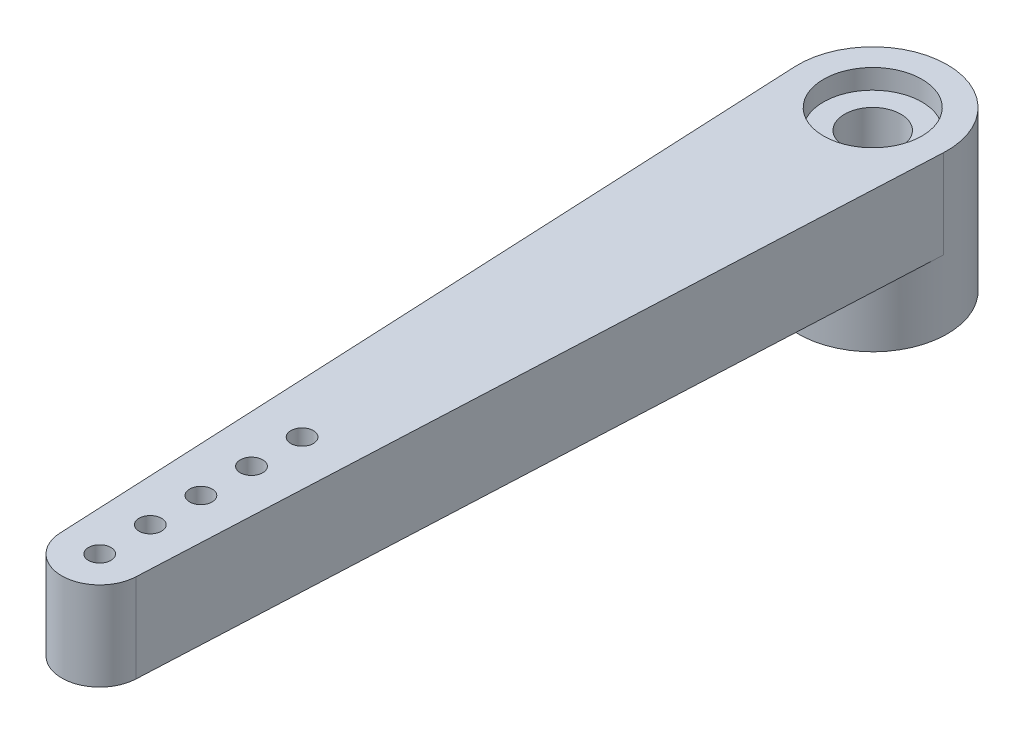
from build123d import *

# Parameters (mm, degrees)
BOSS_EXTRUDE1_DEPTH = 4
BOSS_EXTRUDE2_START = 3.175
SKETCH2_R           = 3.3655
BOSS_EXTRUDE2_DEPTH = 3.175
CUT_EXTRUDE1_DEPTH  = 2.286
CUT_EXTRUDE2_START  = -0.889
SKETCH4_R           = 2.2225
CUT_EXTRUDE2_DEPTH  = 0.889
CUT_EXTRUDE3_REACH  = 39.322
SKETCH5_R           = 1.27
CUT_EXTRUDE4_REACH  = 39.482
SKETCH6_R           = 0.508


with BuildPart() as part:
    # Sketch1 → Boss-Extrude1 (new body)
    with BuildSketch(Plane(origin=(0, 0, 0), x_dir=(1, 0, 0), z_dir=(0, 1, 0))):
        with BuildLine():
            Line((-1.712582674, -35.001060696), (-3.361736359, -0.159119144))
            ThreePointArc((-3.361736359, -0.159119144), (0, 3.3655), (3.361736359, -0.159119144))
            Line((3.361736359, -0.159119144), (1.712582674, -35.001060696))
            ThreePointArc((1.712582674, -35.001060696), (0, -36.6345), (-1.712582674, -35.001060696))
        make_face()
    extrude(amount=BOSS_EXTRUDE1_DEPTH)

    # Sketch2 → Boss-Extrude2 (add)
    with BuildSketch(Plane.XZ.offset(BOSS_EXTRUDE2_START)):
        with Locations(Location((0, 0, 0), (0, 0, 270))):
            Circle(SKETCH2_R)
    extrude(amount=-BOSS_EXTRUDE2_DEPTH)

    # Sketch3 → Cut-Extrude1 (cut)
    with BuildSketch(Plane(origin=(0, -3.175, 0), x_dir=(-1, 0, 0), z_dir=(0, -1, 0))):
        with BuildLine():
            Line((0.344662185, 2.452398872), (0.160511142, 2.216696286))
            ThreePointArc((0.160511142, 2.216696286), (0.155033763, 2.217086102), (0.149555438, 2.217462383))
            Line((0.149555438, 2.217462383), (0, 2.4765))
            Line((0, 2.4765), (-0.149555438, 2.217462383))
            ThreePointArc((-0.149555438, 2.217462383), (-0.155033763, 2.217086102), (-0.160511142, 2.216696286))
            Line((-0.160511142, 2.216696286), (-0.344662185, 2.452398872))
            Line((-0.344662185, 2.452398872), (-0.456711091, 2.175068098))
            ThreePointArc((-0.456711091, 2.175068098), (-0.462083733, 2.173933043), (-0.467453554, 2.172784717))
            Line((-0.467453554, 2.172784717), (-0.682615912, 2.38056459))
            Line((-0.682615912, 2.38056459), (-0.754977382, 2.090338586))
            ThreePointArc((-0.754977382, 2.090338586), (-0.760139769, 2.08846685), (-0.765297515, 2.086582364))
            Line((-0.765297515, 2.086582364), (-1.007283297, 2.262395326))
            Line((-1.007283297, 2.262395326), (-1.038548897, 1.964923011))
            ThreePointArc((-1.038548897, 1.964923011), (-1.043400548, 1.962351025), (-1.04824583, 1.95976706))
            Line((-1.04824583, 1.95976706), (-1.312345058, 2.10019111))
            Line((-1.312345058, 2.10019111), (-1.301906239, 1.801262445))
            ThreePointArc((-1.301906239, 1.801262445), (-1.306352723, 1.79804027), (-1.310791233, 1.794807119))
            Line((-1.310791233, 1.794807119), (-1.591863515, 1.897109063))
            Line((-1.591863515, 1.897109063), (-1.539923457, 1.602542354))
            ThreePointArc((-1.539923457, 1.602542354), (-1.543878228, 1.598732706), (-1.547823575, 1.594913299))
            Line((-1.547823575, 1.594913299), (-1.84039816, 1.657101947))
            Line((-1.84039816, 1.657101947), (-1.747967817, 1.372630599))
            ThreePointArc((-1.747967817, 1.372630599), (-1.7513539, 1.368307629), (-1.754729292, 1.363976306))
            Line((-1.754729292, 1.363976306), (-2.053111548, 1.384841225))
            Line((-2.053111548, 1.384841225), (-1.921989971, 1.116002151))
            ThreePointArc((-1.921989971, 1.116002151), (-1.92474146, 1.11125), (-1.927481199, 1.106491065))
            Line((-1.927481199, 1.106491065), (-2.225863456, 1.085626145))
            Line((-2.225863456, 1.085626145), (-2.058602777, 0.837651991))
            ThreePointArc((-2.058602777, 0.837651991), (-2.060666117, 0.832563154), (-2.062716877, 0.827469234))
            Line((-2.062716877, 0.827469234), (-2.355291463, 0.765280587))
            Line((-2.355291463, 0.765280587), (-2.155147221, 0.542997887))
            ThreePointArc((-2.155147221, 0.542997887), (-2.156482252, 0.537671413), (-2.157804118, 0.532341657))
            Line((-2.157804118, 0.532341657), (-2.4388764, 0.430039712))
            Line((-2.4388764, 0.430039712), (-2.209744176, 0.237774947))
            ThreePointArc((-2.209744176, 0.237774947), (-2.210324912, 0.23231451), (-2.210892156, 0.226852654))
            Line((-2.210892156, 0.226852654), (-2.474991383, 0.086428604))
            Line((-2.474991383, 0.086428604), (-2.221330975, -0.072076012))
            ThreePointArc((-2.221330975, -0.072076012), (-2.221146113, -0.077564131), (-2.220947692, -0.083051778))
            Line((-2.220947692, -0.083051778), (-2.462933474, -0.258864739))
            Line((-2.462933474, -0.258864739), (-2.189682092, -0.380524093))
            ThreePointArc((-2.189682092, -0.380524093), (-2.188735231, -0.385933075), (-2.187775009, -0.391339701))
            Line((-2.187775009, -0.391339701), (-2.402937366, -0.599119574))
            Line((-2.402937366, -0.599119574), (-2.115413539, -0.681565705))
            ThreePointArc((-2.115413539, -0.681565705), (-2.113723107, -0.68679027), (-2.112019773, -0.692010642))
            Line((-2.112019773, -0.692010642), (-2.296170816, -0.927713229))
            Line((-2.296170816, -0.927713229), (-1.999970867, -0.969341417))
            ThreePointArc((-1.999970867, -0.969341417), (-1.997569768, -0.974279874), (-1.995156475, -0.979212383))
            Line((-1.995156475, -0.979212383), (-2.144711912, -1.23825))
            Line((-2.144711912, -1.23825), (-1.845601037, -1.23825))
            ThreePointArc((-1.845601037, -1.23825), (-1.842536005, -1.242806228), (-1.839459725, -1.247354869))
            Line((-1.839459725, -1.247354869), (-1.951508631, -1.524685644))
            Line((-1.951508631, -1.524685644), (-1.655308682, -1.483057456))
            ThreePointArc((-1.655308682, -1.483057456), (-1.651639375, -1.487142773), (-1.647959984, -1.491219011))
            Line((-1.647959984, -1.491219011), (-1.720321454, -1.781445016))
            Line((-1.720321454, -1.781445016), (-1.432797627, -1.698998885))
            ThreePointArc((-1.432797627, -1.698998885), (-1.428595463, -1.702533775), (-1.424384577, -1.706058272))
            Line((-1.424384577, -1.706058272), (-1.455650177, -2.003530587))
            Line((-1.455650177, -2.003530587), (-1.182398796, -1.881871233))
            ThreePointArc((-1.182398796, -1.881871233), (-1.177745565, -1.884786894), (-1.173085144, -1.887691048))
            Line((-1.173085144, -1.887691048), (-1.162646325, -2.186619714))
            Line((-1.162646325, -2.186619714), (-0.908985917, -2.028115099))
            ThreePointArc((-0.908985917, -2.028115099), (-0.903972189, -2.03035478), (-0.898952943, -2.032582066))
            Line((-0.898952943, -2.032582066), (-0.847012885, -2.327148775))
            Line((-0.847012885, -2.327148775), (-0.617880661, -2.134884011))
            ThreePointArc((-0.617880661, -2.134884011), (-0.612604023, -2.136404119), (-0.607323646, -2.137911186))
            Line((-0.607323646, -2.137911186), (-0.514893302, -2.422382533))
            Line((-0.514893302, -2.422382533), (-0.314749061, -2.200099834))
            ThreePointArc((-0.314749061, -2.200099834), (-0.309312217, -2.200870783), (-0.303873485, -2.201628296))
            Line((-0.303873485, -2.201628296), (-0.172751907, -2.47046737))
            Line((-0.172751907, -2.47046737), (-0.005491228, -2.222493216))
            ThreePointArc((-0.005491228, -2.222493216), (0, -2.2225), (0.005491228, -2.222493216))
            Line((0.005491228, -2.222493216), (0.172751907, -2.47046737))
            Line((0.172751907, -2.47046737), (0.303873485, -2.201628296))
            ThreePointArc((0.303873485, -2.201628296), (0.309312217, -2.200870783), (0.314749061, -2.200099834))
            Line((0.314749061, -2.200099834), (0.514893302, -2.422382533))
            Line((0.514893302, -2.422382533), (0.607323646, -2.137911186))
            ThreePointArc((0.607323646, -2.137911186), (0.612604023, -2.136404119), (0.617880661, -2.134884011))
            Line((0.617880661, -2.134884011), (0.847012885, -2.327148775))
            Line((0.847012885, -2.327148775), (0.898952943, -2.032582066))
            ThreePointArc((0.898952943, -2.032582066), (0.903972189, -2.03035478), (0.908985917, -2.028115099))
            Line((0.908985917, -2.028115099), (1.162646325, -2.186619714))
            Line((1.162646325, -2.186619714), (1.173085144, -1.887691048))
            ThreePointArc((1.173085144, -1.887691048), (1.177745565, -1.884786894), (1.182398796, -1.881871233))
            Line((1.182398796, -1.881871233), (1.455650177, -2.003530587))
            Line((1.455650177, -2.003530587), (1.424384577, -1.706058272))
            ThreePointArc((1.424384577, -1.706058272), (1.428595463, -1.702533775), (1.432797627, -1.698998885))
            Line((1.432797627, -1.698998885), (1.720321454, -1.781445016))
            Line((1.720321454, -1.781445016), (1.647959984, -1.491219011))
            ThreePointArc((1.647959984, -1.491219011), (1.651639375, -1.487142773), (1.655308682, -1.483057456))
            Line((1.655308682, -1.483057456), (1.951508631, -1.524685644))
            Line((1.951508631, -1.524685644), (1.839459725, -1.247354869))
            ThreePointArc((1.839459725, -1.247354869), (1.842536005, -1.242806228), (1.845601037, -1.23825))
            Line((1.845601037, -1.23825), (2.144711912, -1.23825))
            Line((2.144711912, -1.23825), (1.995156475, -0.979212383))
            ThreePointArc((1.995156475, -0.979212383), (1.997569768, -0.974279874), (1.999970867, -0.969341417))
            Line((1.999970867, -0.969341417), (2.296170816, -0.927713229))
            Line((2.296170816, -0.927713229), (2.112019773, -0.692010642))
            ThreePointArc((2.112019773, -0.692010642), (2.113723107, -0.68679027), (2.115413539, -0.681565705))
            Line((2.115413539, -0.681565705), (2.402937366, -0.599119574))
            Line((2.402937366, -0.599119574), (2.187775009, -0.391339701))
            ThreePointArc((2.187775009, -0.391339701), (2.188735231, -0.385933075), (2.189682092, -0.380524093))
            Line((2.189682092, -0.380524093), (2.462933474, -0.258864739))
            Line((2.462933474, -0.258864739), (2.220947692, -0.083051778))
            ThreePointArc((2.220947692, -0.083051778), (2.221146113, -0.077564131), (2.221330975, -0.072076012))
            Line((2.221330975, -0.072076012), (2.474991383, 0.086428604))
            Line((2.474991383, 0.086428604), (2.210892156, 0.226852654))
            ThreePointArc((2.210892156, 0.226852654), (2.210324912, 0.23231451), (2.209744176, 0.237774947))
            Line((2.209744176, 0.237774947), (2.4388764, 0.430039712))
            Line((2.4388764, 0.430039712), (2.157804118, 0.532341657))
            ThreePointArc((2.157804118, 0.532341657), (2.156482252, 0.537671413), (2.155147221, 0.542997887))
            Line((2.155147221, 0.542997887), (2.355291463, 0.765280587))
            Line((2.355291463, 0.765280587), (2.062716877, 0.827469234))
            ThreePointArc((2.062716877, 0.827469234), (2.060666117, 0.832563154), (2.058602777, 0.837651991))
            Line((2.058602777, 0.837651991), (2.225863456, 1.085626145))
            Line((2.225863456, 1.085626145), (1.927481199, 1.106491065))
            ThreePointArc((1.927481199, 1.106491065), (1.92474146, 1.11125), (1.921989971, 1.116002151))
            Line((1.921989971, 1.116002151), (2.053111548, 1.384841225))
            Line((2.053111548, 1.384841225), (1.754729292, 1.363976306))
            ThreePointArc((1.754729292, 1.363976306), (1.7513539, 1.368307629), (1.747967817, 1.372630599))
            Line((1.747967817, 1.372630599), (1.84039816, 1.657101947))
            Line((1.84039816, 1.657101947), (1.547823575, 1.594913299))
            ThreePointArc((1.547823575, 1.594913299), (1.543878228, 1.598732706), (1.539923457, 1.602542354))
            Line((1.539923457, 1.602542354), (1.591863515, 1.897109063))
            Line((1.591863515, 1.897109063), (1.310791233, 1.794807119))
            ThreePointArc((1.310791233, 1.794807119), (1.306352723, 1.79804027), (1.301906239, 1.801262445))
            Line((1.301906239, 1.801262445), (1.312345058, 2.10019111))
            Line((1.312345058, 2.10019111), (1.04824583, 1.95976706))
            ThreePointArc((1.04824583, 1.95976706), (1.043400548, 1.962351025), (1.038548897, 1.964923011))
            Line((1.038548897, 1.964923011), (1.007283297, 2.262395326))
            Line((1.007283297, 2.262395326), (0.765297515, 2.086582364))
            ThreePointArc((0.765297515, 2.086582364), (0.760139769, 2.08846685), (0.754977382, 2.090338586))
            Line((0.754977382, 2.090338586), (0.682615912, 2.38056459))
            Line((0.682615912, 2.38056459), (0.467453554, 2.172784717))
            ThreePointArc((0.467453554, 2.172784717), (0.462083733, 2.173933043), (0.456711091, 2.175068098))
            Line((0.456711091, 2.175068098), (0.344662185, 2.452398872))
        make_face()
    extrude(amount=-CUT_EXTRUDE1_DEPTH, mode=Mode.SUBTRACT)

    # Sketch4 → Cut-Extrude2 (cut)
    with BuildSketch(Plane(origin=(0, 4, 0), x_dir=(1, 0, 0), z_dir=(0, 1, 0)).offset(CUT_EXTRUDE2_START)):
        with Locations(Location((0, 0, 0), (0, 0, 270))):
            Circle(SKETCH4_R)
    extrude(amount=CUT_EXTRUDE2_DEPTH, mode=Mode.SUBTRACT)

    # Sketch5 → Cut-Extrude3 (cut, up to next)
    with BuildSketch(Plane(origin=(0, 3.111, 0), x_dir=(1, 0, 0), z_dir=(0, 1, 0)), mode=Mode.PRIVATE) as cut_extrude3_sk1:
        with Locations(Location((0, 0, 0), (0, 0, 270))):
            Circle(SKETCH5_R)
    cut_extrude3_tool1 = extrude(cut_extrude3_sk1.sketch, amount=-CUT_EXTRUDE3_REACH, mode=Mode.PRIVATE) & part.part
    add(cut_extrude3_tool1.solids().sort_by_distance((0, 3.111, 0))[0], mode=Mode.SUBTRACT)

    # Sketch6 → Cut-Extrude4 (cut, up to next)
    with BuildSketch(Plane(origin=(0, 4, 0), x_dir=(1, 0, 0), z_dir=(0, 1, 0)), mode=Mode.PRIVATE) as cut_extrude4_sk1:
        with Locations(Location((0, -34.92, 0), (0, 0, 270))):
            Circle(SKETCH6_R)
    cut_extrude4_tool1 = extrude(cut_extrude4_sk1.sketch, amount=-CUT_EXTRUDE4_REACH, mode=Mode.PRIVATE) & part.part
    # Sketch6 → Cut-Extrude4 (cut, up to next)
    with BuildSketch(Plane(origin=(0, 4, 0), x_dir=(1, 0, 0), z_dir=(0, 1, 0)), mode=Mode.PRIVATE) as cut_extrude4_sk2:
        with Locations(Location((0, -32.634, 0), (0, 0, 270))):
            Circle(SKETCH6_R)
    cut_extrude4_tool2 = extrude(cut_extrude4_sk2.sketch, amount=-CUT_EXTRUDE4_REACH, mode=Mode.PRIVATE) & part.part
    # Sketch6 → Cut-Extrude4 (cut, up to next)
    with BuildSketch(Plane(origin=(0, 4, 0), x_dir=(1, 0, 0), z_dir=(0, 1, 0)), mode=Mode.PRIVATE) as cut_extrude4_sk3:
        with Locations(Location((0, -30.348, 0), (0, 0, 270))):
            Circle(SKETCH6_R)
    cut_extrude4_tool3 = extrude(cut_extrude4_sk3.sketch, amount=-CUT_EXTRUDE4_REACH, mode=Mode.PRIVATE) & part.part
    # Sketch6 → Cut-Extrude4 (cut, up to next)
    with BuildSketch(Plane(origin=(0, 4, 0), x_dir=(1, 0, 0), z_dir=(0, 1, 0)), mode=Mode.PRIVATE) as cut_extrude4_sk4:
        with Locations(Location((0, -28.062, 0), (0, 0, 270))):
            Circle(SKETCH6_R)
    cut_extrude4_tool4 = extrude(cut_extrude4_sk4.sketch, amount=-CUT_EXTRUDE4_REACH, mode=Mode.PRIVATE) & part.part
    # Sketch6 → Cut-Extrude4 (cut, up to next)
    with BuildSketch(Plane(origin=(0, 4, 0), x_dir=(1, 0, 0), z_dir=(0, 1, 0)), mode=Mode.PRIVATE) as cut_extrude4_sk5:
        with Locations(Location((0, -25.776, 0), (0, 0, 270))):
            Circle(SKETCH6_R)
    cut_extrude4_tool5 = extrude(cut_extrude4_sk5.sketch, amount=-CUT_EXTRUDE4_REACH, mode=Mode.PRIVATE) & part.part
    add(cut_extrude4_tool1.solids().sort_by_distance((0, 4, 34.92))[0], mode=Mode.SUBTRACT)
    add(cut_extrude4_tool2.solids().sort_by_distance((0, 4, 32.634))[0], mode=Mode.SUBTRACT)
    add(cut_extrude4_tool3.solids().sort_by_distance((0, 4, 30.348))[0], mode=Mode.SUBTRACT)
    add(cut_extrude4_tool4.solids().sort_by_distance((0, 4, 28.062))[0], mode=Mode.SUBTRACT)
    add(cut_extrude4_tool5.solids().sort_by_distance((0, 4, 25.776))[0], mode=Mode.SUBTRACT)


solid = part.part
